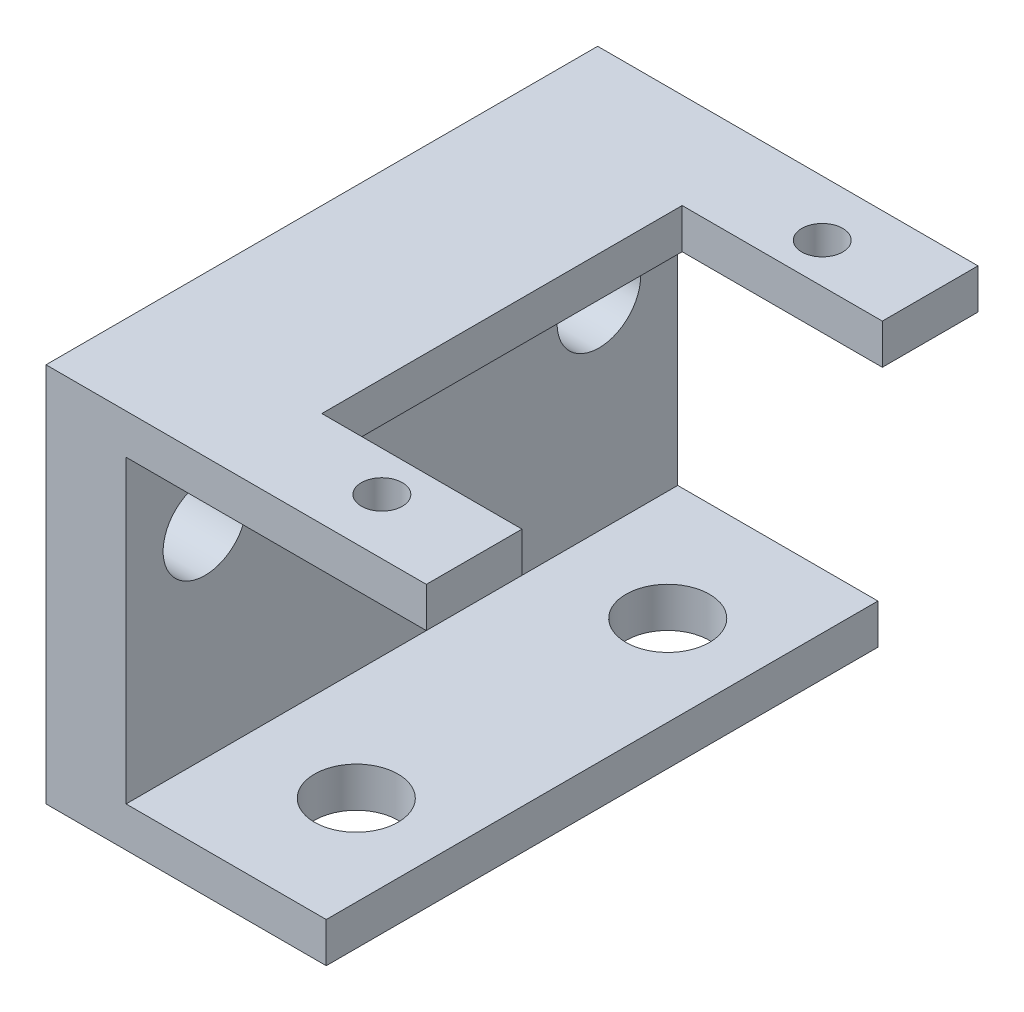
from build123d import *

# Parameters (mm, degrees)
SKETCH1_W                 = 5.08
SKETCH1_H                 = 19.05
BOSS_EXTRUDE1_DEPTH       = 35
F_5_0MM_DOWEL_HOLE1_D     = 5.3
F_5_0MM_DOWEL_HOLE2_D     = 5.3
F_5_0MM_DOWEL_HOLE2_DEPTH = 2.54
CUT_EXTRUDE1_REACH        = 50.883
SKETCH6_W                 = 12.7
SKETCH6_H                 = 22.86
M2_CLEARANCE_HOLE1_D      = 2.6
M2_CLEARANCE_HOLE1_DEPTH  = 2.54


with BuildPart() as part:
    # Sketch1 → Boss-Extrude1 (new body)
    with BuildSketch(Plane.XY):
        Polygon((0, 2.54), (0, 0), (17.78, 0), (17.78, 2.54), (5.08, 2.54), align=None)
        with Locations((2.54, 12.065)):
            Rectangle(SKETCH1_W, SKETCH1_H)
        Polygon((0, 24.13), (0, 21.59), (5.08, 21.59), (24.13, 21.59), (24.13, 24.13), align=None)
    extrude(amount=BOSS_EXTRUDE1_DEPTH)

    # Ø5.0mm Dowel Hole1 (through all)
    with Locations(Plane(origin=(5.08, 0, 0), x_dir=(0, 0, -1), z_dir=(1, 0, 0))):
        with Locations((-30, 15.24), (-5, 15.24)):
            Hole(F_5_0MM_DOWEL_HOLE1_D / 2)

    # Ø5.0mm Dowel Hole2
    with Locations(Plane(origin=(0, 2.54, 0), x_dir=(1, 0, 0), z_dir=(0, 1, 0))):
        with Locations((12.065, -27.38), (12.065, -7.62)):
            Hole(F_5_0MM_DOWEL_HOLE2_D / 2, depth=F_5_0MM_DOWEL_HOLE2_DEPTH)

    # Sketch6 → Cut-Extrude1 (cut, up to next)
    with BuildSketch(Plane(origin=(0, 24.13, 0), x_dir=(1, 0, 0), z_dir=(0, 1, 0)), mode=Mode.PRIVATE) as cut_extrude1_sk1:
        with Locations((17.78, -17.5)):
            Rectangle(SKETCH6_W, SKETCH6_H)
    cut_extrude1_tool1 = extrude(cut_extrude1_sk1.sketch, amount=-CUT_EXTRUDE1_REACH, mode=Mode.PRIVATE) & part.part
    add(cut_extrude1_tool1.solids().sort_by_distance((17.78, 24.13, 17.5))[0], mode=Mode.SUBTRACT)

    # M2 Clearance Hole1
    with Locations(Plane(origin=(0, 24.13, 0), x_dir=(1, 0, 0), z_dir=(0, 1, 0))):
        with Locations((17.78, -31.47), (17.78, -3.53)):
            Hole(M2_CLEARANCE_HOLE1_D / 2, depth=M2_CLEARANCE_HOLE1_DEPTH)


solid = part.part
